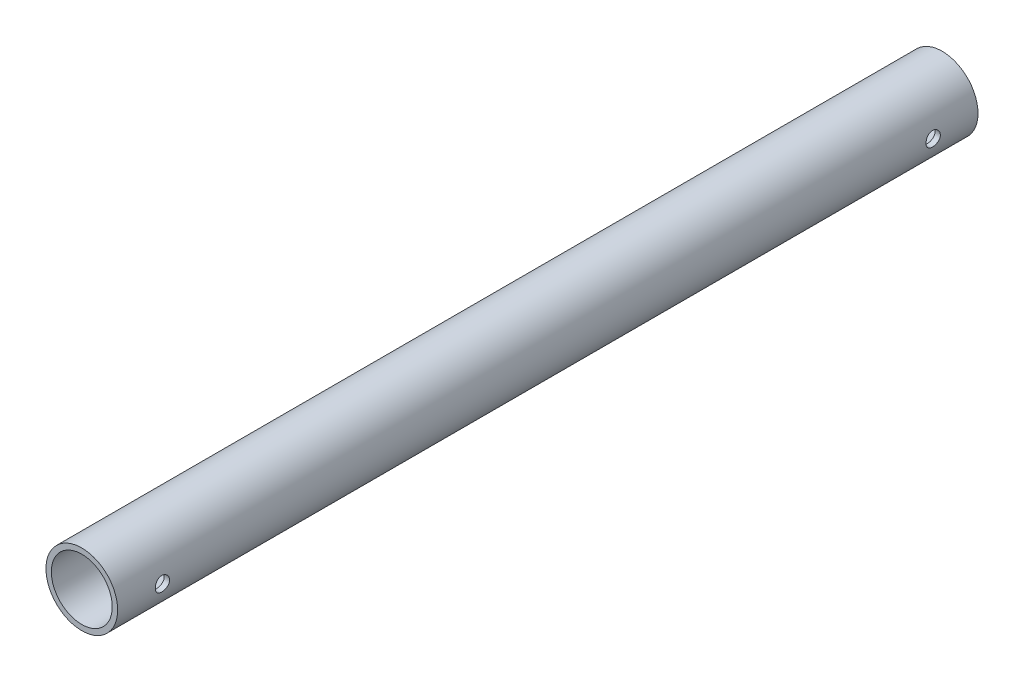
from build123d import *

# Parameters (mm, degrees)
SKETCH1_R           = 10
SKETCH1_R_2         = 8.5
BOSS_EXTRUDE1_DEPTH = 120
SKETCH2_R           = 2
CUT_EXTRUDE1_DEPTH  = 121.830459736


with BuildPart() as part:
    # Sketch1 → Boss-Extrude1 (new body)
    with BuildSketch(Plane.XY):
        Circle(SKETCH1_R)
        Circle(SKETCH1_R_2, mode=Mode.SUBTRACT)
    boss_extrude1 = extrude(amount=BOSS_EXTRUDE1_DEPTH)

    # Sketch2 → Cut-Extrude1 (cut, symmetric)
    with BuildSketch(Plane(origin=(0, 0, 0), x_dir=(0, 0, -1), z_dir=(1, 0, 0))):
        with Locations((-107.5, 0)):
            Circle(SKETCH2_R)
    cut_extrude1 = extrude(amount=CUT_EXTRUDE1_DEPTH, both=True, mode=Mode.SUBTRACT)

    # Mirror1: Boss-Extrude1, Cut-Extrude1 across plane
    add(boss_extrude1.mirror(Plane.XY))
    add(cut_extrude1.mirror(Plane.XY), mode=Mode.SUBTRACT)


solid = part.part
